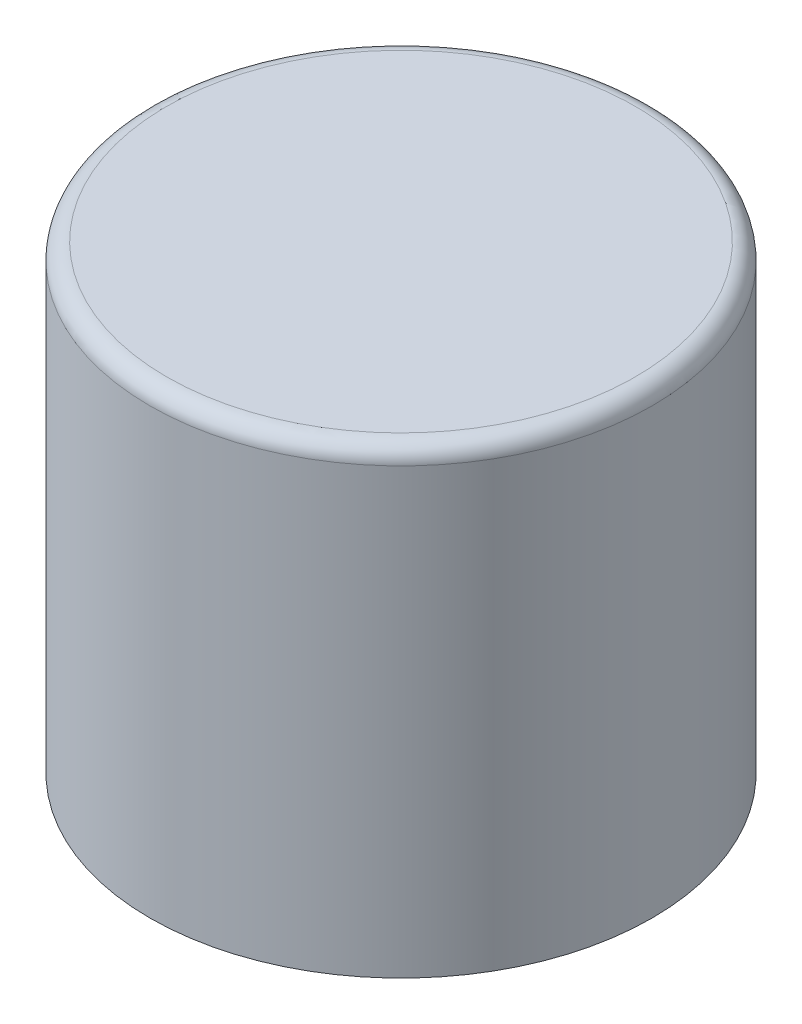
from build123d import *

# Parameters (mm, degrees)
SKETCH1_W          = 3
SKETCH1_H          = 5.5
SKETCH2_W          = 2.5
SKETCH2_H          = 2.5
CUT_EXTRUDE1_DEPTH = 2.8
FILLET1_R          = 0.2


with BuildPart() as part:
    # Sketch1 → Revolve1 (revolve)
    with BuildSketch(Plane(origin=(0, 0, 0), x_dir=(-1, 0, 0), z_dir=(0, 0, -1)), mode=Mode.PRIVATE) as revolve1_sk:
        with Locations((-1.5, 2.75)):
            Rectangle(SKETCH1_W, SKETCH1_H)
    revolve(revolve1_sk.sketch.rotate(Axis((0, 0, 0), (0, 1, 0)), 270), axis=Axis((0, 0, 0), (0, 1, 0)))

    # Sketch2 → Cut-Extrude1 (cut)
    with BuildSketch(Plane.XZ):
        Rectangle(SKETCH2_W, SKETCH2_H)
    extrude(amount=-CUT_EXTRUDE1_DEPTH, mode=Mode.SUBTRACT)

    # Fillet1
    fillet1_edges = [part.edges().sort_by_distance(p)[0] for p in [
        (0, 5.5, -3),
    ]]
    fillet(fillet1_edges, radius=FILLET1_R)


solid = part.part
